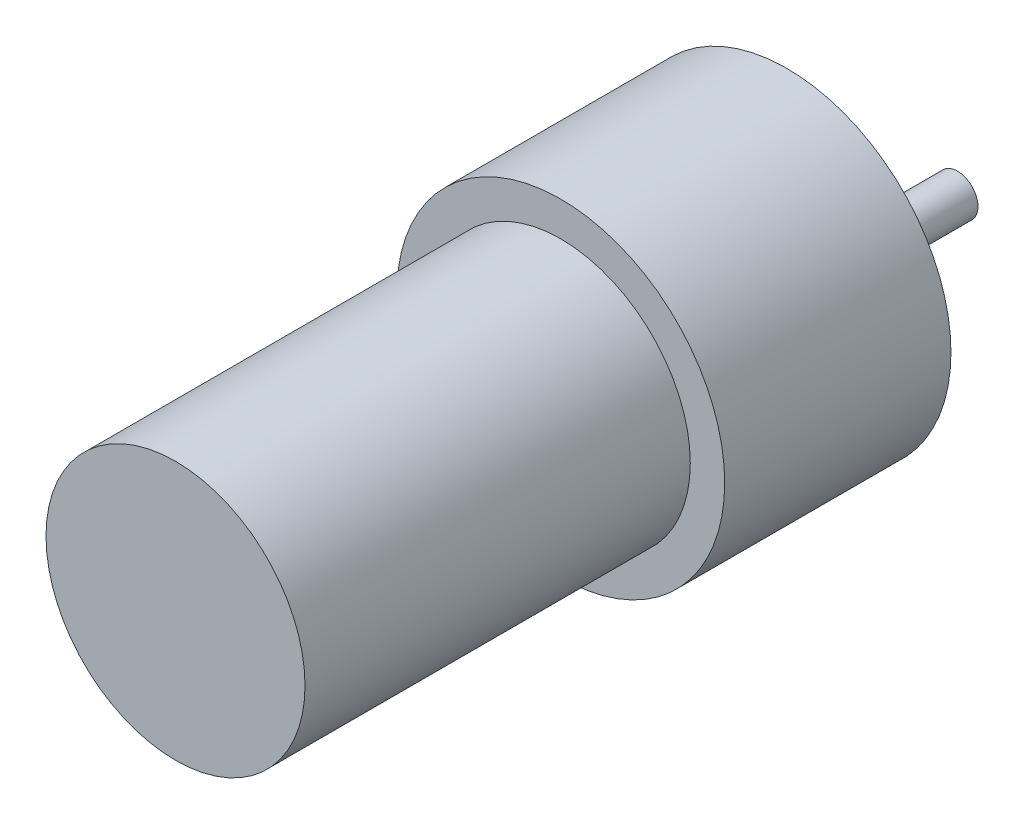
from build123d import *

# Parameters (mm, degrees)
SKETCH1_R           = 25.4
BOSS_EXTRUDE1_DEPTH = 35.052
SKETCH2_R           = 20.066
BOSS_EXTRUDE2_DEPTH = 59.69
SKETCH3_R           = 3.175
BOSS_EXTRUDE3_DEPTH = 26.416


with BuildPart() as part:
    # Sketch1 → Boss-Extrude1 (new body)
    with BuildSketch(Plane.XY):
        Circle(SKETCH1_R)
    extrude(amount=BOSS_EXTRUDE1_DEPTH)

    # Sketch2 → Boss-Extrude2 (add)
    with BuildSketch(Plane.XY.offset(35.052)):
        with Locations(Location((0, 0, 0), (0, 0, 180))):
            Circle(SKETCH2_R)
    extrude(amount=BOSS_EXTRUDE2_DEPTH)

    # Sketch3 → Boss-Extrude3 (add)
    with BuildSketch(Plane(origin=(0, 0, 0), x_dir=(-1, 0, 0), z_dir=(0, 0, -1))):
        with Locations(Location((0, -4.7625, 0), (0, 0, 180))):
            Circle(SKETCH3_R)
    extrude(amount=BOSS_EXTRUDE3_DEPTH)


solid = part.part
